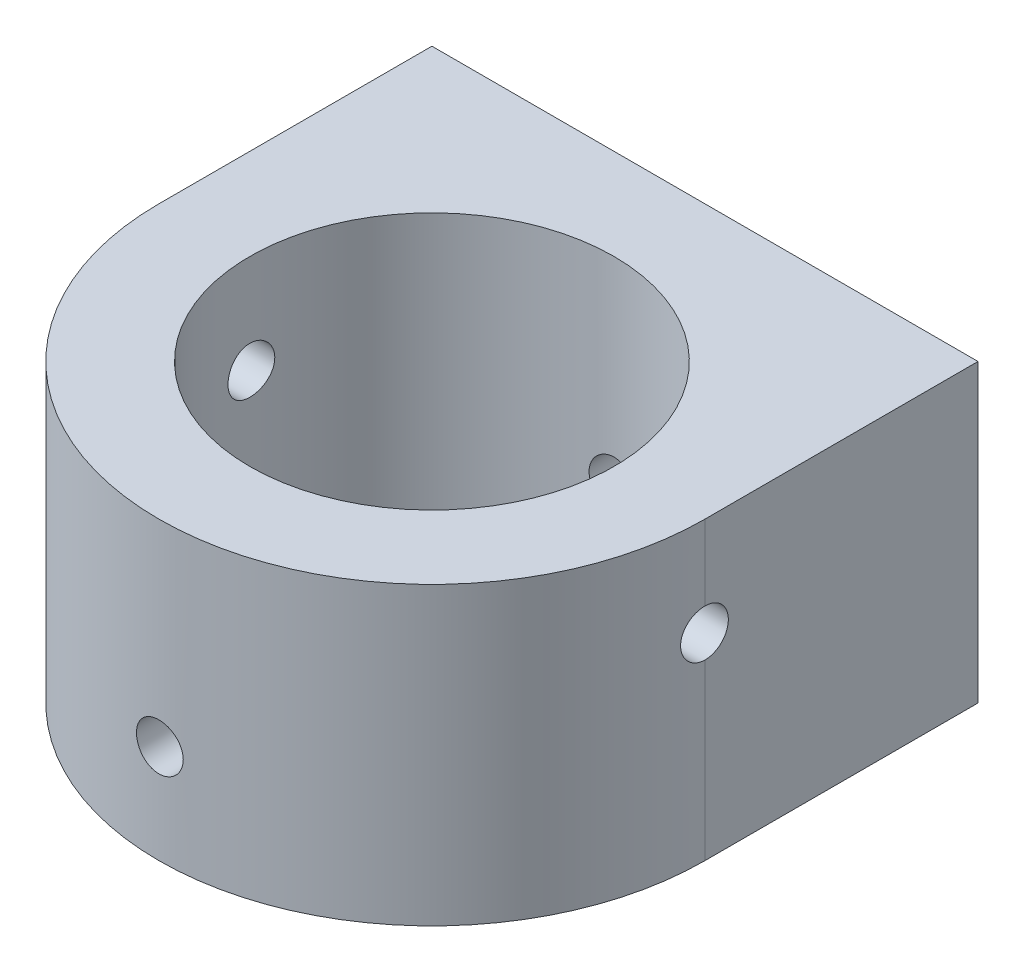
from build123d import *

# Parameters (mm, degrees)
BOSS_EXTRUDE1_DEPTH     = 41.275
CUT_EXTRUDE1_DEPTH      = 68.873747686
CUT_EXTRUDE1_DEPTH_BACK = 68.873747686
SKETCH2_R               = 25.4
CUT_EXTRUDE2_DEPTH      = 68.873747686
CUT_EXTRUDE2_DEPTH_BACK = 68.873747686
SKETCH3_R               = 3.2639
CUT_EXTRUDE3_DEPTH      = 68.87374786
CUT_EXTRUDE3_DEPTH_BACK = 68.87374786
SKETCH4_R               = 3.2639


with BuildPart() as part:
    # Sketch1 → Boss-Extrude1 (new body)
    with BuildSketch(Plane(origin=(0, 0, 0), x_dir=(-1, 0, 0), z_dir=(0, 1, 0))):
        with BuildLine():
            Line((-38.1, 0), (-38.1, -38.1))
            Line((-38.1, -38.1), (38.1, -38.1))
            Line((38.1, -38.1), (38.1, 0))
            ThreePointArc((38.1, 0), (0, 38.1), (-38.1, 0))
        make_face()
    extrude(amount=BOSS_EXTRUDE1_DEPTH)

    # Sketch2 → Cut-Extrude1 (cut, two sides: drawn at the far end of the back side and taken through both)
    with BuildSketch(Plane(origin=(0, 41.275, 0), x_dir=(-1, 0, 0), z_dir=(0, 1, 0)).offset(-CUT_EXTRUDE1_DEPTH_BACK)):
        with Locations(Location((0, 0, 0), (0, 0, 90))):
            Circle(SKETCH2_R)
    extrude(amount=CUT_EXTRUDE1_DEPTH + CUT_EXTRUDE1_DEPTH_BACK, mode=Mode.SUBTRACT)

    # Sketch3 → Cut-Extrude2 (cut, two sides: drawn at the far end of the back side and taken through both)
    with BuildSketch(Plane(origin=(0, 0, 0), x_dir=(0, 1, 0), z_dir=(0, 0, 1)).offset(-CUT_EXTRUDE2_DEPTH_BACK)):
        with Locations(Location((13.758333333, 0, 0), (0, 0, 270))):
            Circle(SKETCH3_R)
    extrude(amount=CUT_EXTRUDE2_DEPTH + CUT_EXTRUDE2_DEPTH_BACK, mode=Mode.SUBTRACT)

    # Sketch4 → Cut-Extrude3 (cut, two sides: drawn at the far end of the back side and taken through both)
    with BuildSketch(Plane.YZ.offset(-CUT_EXTRUDE3_DEPTH_BACK)):
        with Locations(Location((27.516666667, 0, 0), (0, 0, 270))):
            Circle(SKETCH4_R)
    extrude(amount=CUT_EXTRUDE3_DEPTH + CUT_EXTRUDE3_DEPTH_BACK, mode=Mode.SUBTRACT)


solid = part.part
